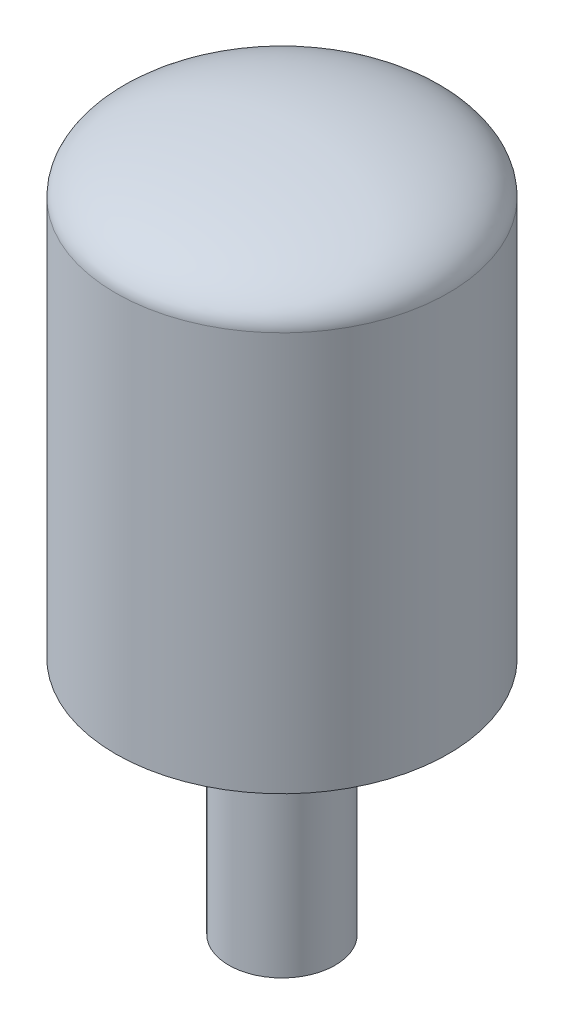
from build123d import *

# Parameters (mm, degrees)
SKETCH3_R           = 2.54
BOSS_EXTRUDE1_DEPTH = 11.43


with BuildPart() as part:
    # Sketch2 → Revolve1 (revolve)
    with BuildSketch(Plane(origin=(0, 0, 0), x_dir=(0, 0, -1), z_dir=(1, 0, 0)), mode=Mode.PRIVATE) as revolve1_sk:
        with BuildLine():
            Line((0, 0), (7.9375, 0))
            Line((7.9375, 0), (7.9375, 19.05))
            add(Edge.make_bspline(
                [(7.9375, 19.05), (7.9375, 21.791809963), (0, 21.791809963)],
                knots=[0, 0, 0, 1.570796327, 1.570796327, 1.570796327], degree=2, weights=[1, 0.707106781, 1]))
            Line((0, 21.791809963), (0, 0))
        make_face()
    revolve(revolve1_sk.sketch.rotate(Axis((0, 21.791809963, 0), (0, -1, 0)), 180), axis=Axis((0, 21.791809963, 0), (0, -1, 0)))

    # Sketch3 → Boss-Extrude1 (add)
    with BuildSketch(Plane.XZ):
        with Locations(Location((0, 0, 0), (0, 0, 270))):
            Circle(SKETCH3_R)
    extrude(amount=BOSS_EXTRUDE1_DEPTH)


solid = part.part
